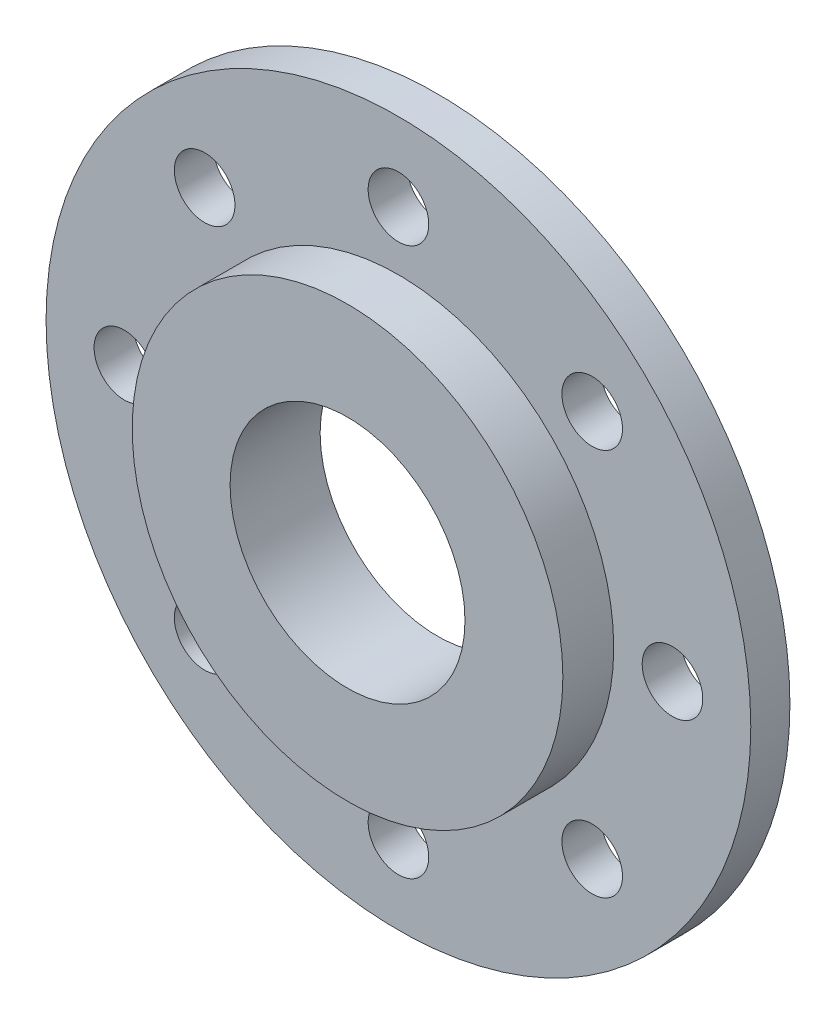
from build123d import *

# Parameters (mm, degrees)
SKETCH1_R                    = 17.4625
BOSS_EXTRUDE1_DEPTH          = 4.1275
SKETCH2_R                    = 28.575
BOSS_EXTRUDE2_DEPTH          = 3.175
F_10_0_1935_DIAMETER_HOLE1_D = 4.9149
CIRPATTERN1_COUNT            = 8
CUT_EXTRUDE1_REACH           = 43.066
SKETCH5_R                    = 9.525


with BuildPart() as part:
    # Sketch1 → Boss-Extrude1 (new body)
    with BuildSketch(Plane.XY):
        Circle(SKETCH1_R)
    extrude(amount=BOSS_EXTRUDE1_DEPTH)

    # Sketch2 → Boss-Extrude2 (add)
    with BuildSketch(Plane(origin=(0, 0, 0), x_dir=(-1, 0, 0), z_dir=(0, 0, -1))):
        Circle(SKETCH2_R)
    extrude(amount=BOSS_EXTRUDE2_DEPTH)

    # #10 (0.1935) Diameter Hole1 (through all)
    with Locations(Plane(origin=(0, 0, -3.175), x_dir=(-1, 0, 0), z_dir=(0, 0, -1))):
        with Locations((0, 22.225)):
            f_10_0_1935_diameter_hole1 = Hole(F_10_0_1935_DIAMETER_HOLE1_D / 2)

    # CirPattern1: #10 (0.1935) Diameter Hole1 ×8 about axis
    cirpattern1_axis = Axis((0, 0, 0), (0, 0, 1))
    for i in range(1, CIRPATTERN1_COUNT):
        add(f_10_0_1935_diameter_hole1.rotate(cirpattern1_axis, i * 360 / CIRPATTERN1_COUNT), mode=Mode.SUBTRACT)

    # Sketch5 → Cut-Extrude1 (cut, up to next)
    with BuildSketch(Plane(origin=(0, 0, -3.175), x_dir=(-1, 0, 0), z_dir=(0, 0, -1)), mode=Mode.PRIVATE) as cut_extrude1_sk1:
        Circle(SKETCH5_R)
    cut_extrude1_tool1 = extrude(cut_extrude1_sk1.sketch, amount=-CUT_EXTRUDE1_REACH, mode=Mode.PRIVATE) & part.part
    add(cut_extrude1_tool1.solids().sort_by_distance((0, 0, -3.175))[0], mode=Mode.SUBTRACT)


solid = part.part
